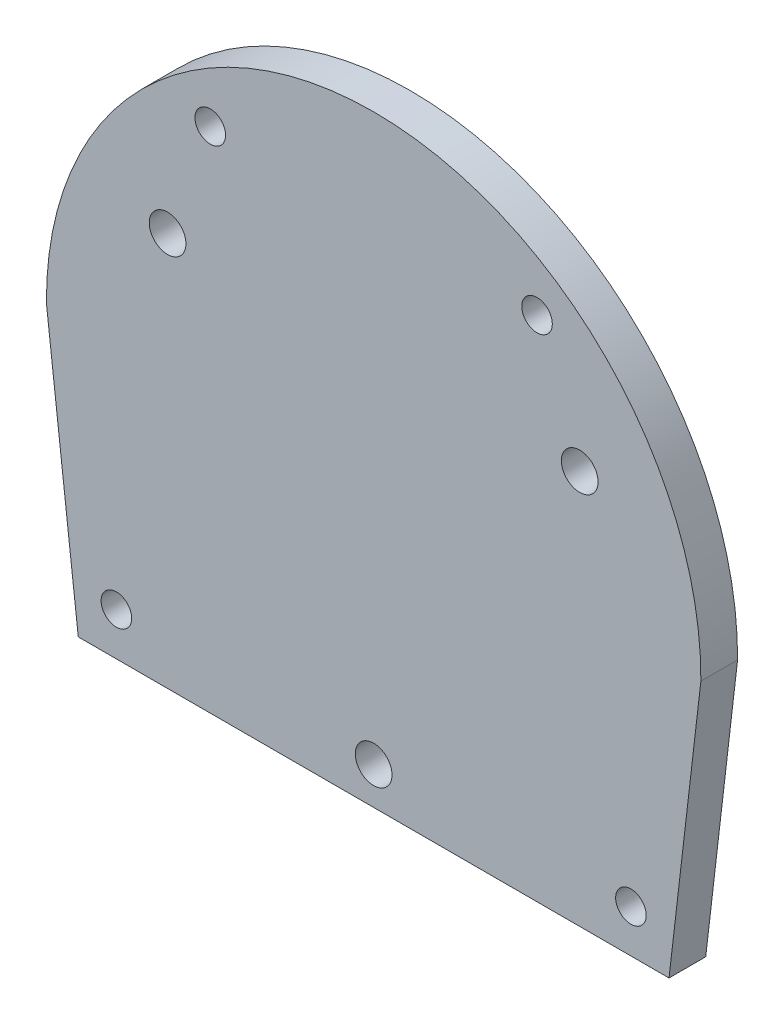
from build123d import *

# Parameters (mm, degrees)
ESQUISSE1_R             = 1.5
BOSS_EXTRU_1_DEPTH      = 3
ESQUISSE2_R             = 1.25
ENL_V_MAT_EXTRU_2_DEPTH = 10


with BuildPart() as part:
    # Esquisse1 → Boss.-Extru.1 (new body)
    with BuildSketch(Plane.XY):
        with BuildLine():
            Line((-26.749397242, -0.17957503), (-24.145347662, -22.5))
            Line((-24.145347662, -22.5), (24.145347662, -22.5))
            Line((24.145347662, -22.5), (26.749397242, -0.17957503))
            ThreePointArc((26.749397242, -0.17957503), (0, 26.75), (-26.749397242, -0.17957503))
        make_face()
        with Locations((0, -19.45)):
            Circle(ESQUISSE1_R, mode=Mode.SUBTRACT)
        with Locations((-16.844194104, 9.725)):
            Circle(ESQUISSE1_R, mode=Mode.SUBTRACT)
        with Locations((16.844194104, 9.725)):
            Circle(ESQUISSE1_R, mode=Mode.SUBTRACT)
    extrude(amount=BOSS_EXTRU_1_DEPTH)

    # Esquisse2 → Enlèv. mat.-Extru.2 (cut)
    with BuildSketch(Plane.XY.offset(3)):
        with Locations((21.029790949, -19.001295206)):
            Circle(ESQUISSE2_R)
        with Locations((13.354846659, 19.031830461)):
            Circle(ESQUISSE2_R)
        with Locations((-13.354846659, 19.031830461)):
            Circle(ESQUISSE2_R)
        with Locations((-21.029790949, -19.001295206)):
            Circle(ESQUISSE2_R)
    extrude(amount=-ENL_V_MAT_EXTRU_2_DEPTH, mode=Mode.SUBTRACT)


solid = part.part
